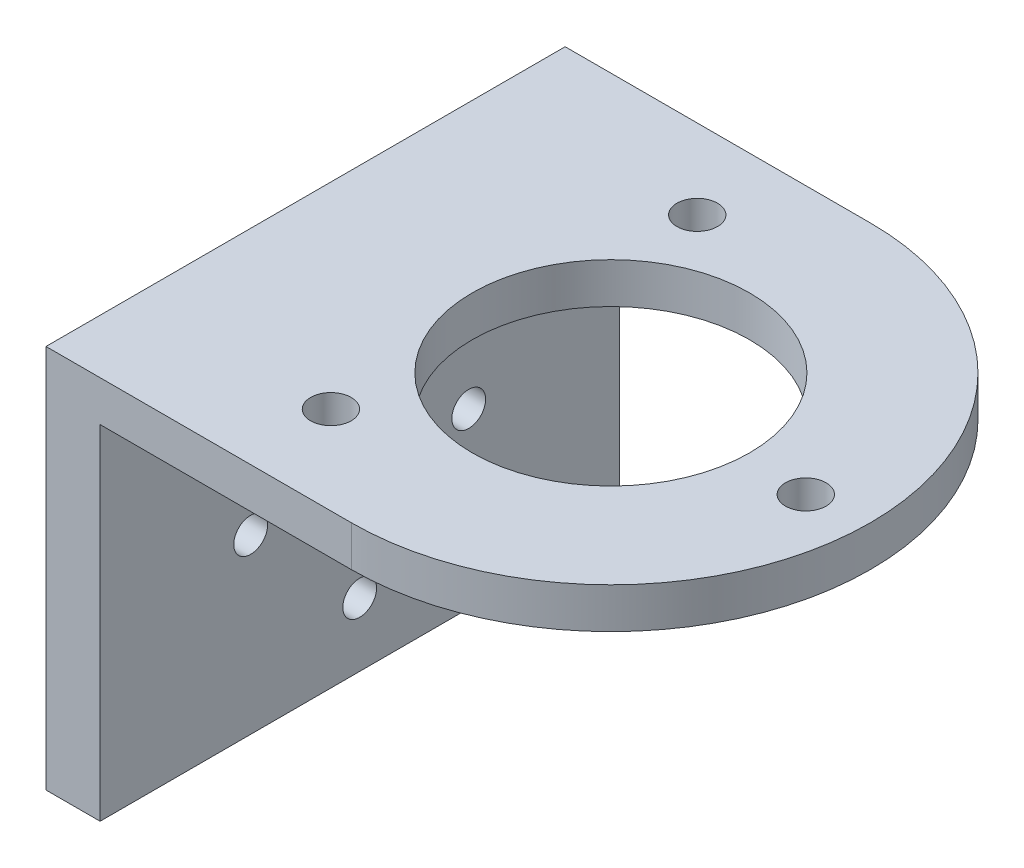
from build123d import *

# Parameters (mm, degrees)
SKETCH1_R           = 10.25
SKETCH1_R_2         = 1.5
BOSS_EXTRUDE3_DEPTH = 3
SKETCH2_W           = 4
SKETCH2_H           = 38.38
BOSS_EXTRUDE4_DEPTH = 25.4
SKETCH3_R           = 1.25
CUT_EXTRUDE2_DEPTH  = 25.4


with BuildPart() as part:
    # Sketch1 → Boss-Extrude3 (new body)
    with BuildSketch(Plane(origin=(0, 0, 0), x_dir=(1, 0, 0), z_dir=(0, 1, 0))):
        with BuildLine():
            Line((-22.571326258, -19.19), (0, -19.19))
            ThreePointArc((0, -19.19), (19.19, 0), (0, 19.19))
            Line((0, 19.19), (-22.571326258, 19.19))
            Line((-22.571326258, 19.19), (-22.571326258, -19.19))
        make_face()
        with Locations(Location((0, 0, 0), (0, 0, 270))):
            Circle(SKETCH1_R, mode=Mode.SUBTRACT)
        with Locations(Location((-6.923626209, 13.306517204, 0), (0, 0, 270))):
            Circle(SKETCH1_R_2, mode=Mode.SUBTRACT)
        with Locations(Location((-8.029460065, -12.669955448, 0), (0, 0, 270))):
            Circle(SKETCH1_R_2, mode=Mode.SUBTRACT)
        with Locations(Location((14.988772764, -0.580250843, 0), (0, 0, 270))):
            Circle(SKETCH1_R_2, mode=Mode.SUBTRACT)
    extrude(amount=BOSS_EXTRUDE3_DEPTH)

    # Sketch2 → Boss-Extrude4 (add)
    with BuildSketch(Plane.XZ):
        with Locations((-20.571326258, 0)):
            Rectangle(SKETCH2_W, SKETCH2_H)
    extrude(amount=BOSS_EXTRUDE4_DEPTH)

    # Sketch3 → Cut-Extrude2 (cut)
    with BuildSketch(Plane(origin=(-18.571326258, 0, 0), x_dir=(0, 0, -1), z_dir=(1, 0, 0))):
        with Locations((0, -4.563544693)):
            Circle(SKETCH3_R)
        with Locations((-8.06, -12.623544693)):
            Circle(SKETCH3_R)
        with Locations((0, -20.683544693)):
            Circle(SKETCH3_R)
        with Locations((8.06, -12.623544693)):
            Circle(SKETCH3_R)
    extrude(amount=-CUT_EXTRUDE2_DEPTH, mode=Mode.SUBTRACT)


solid = part.part
